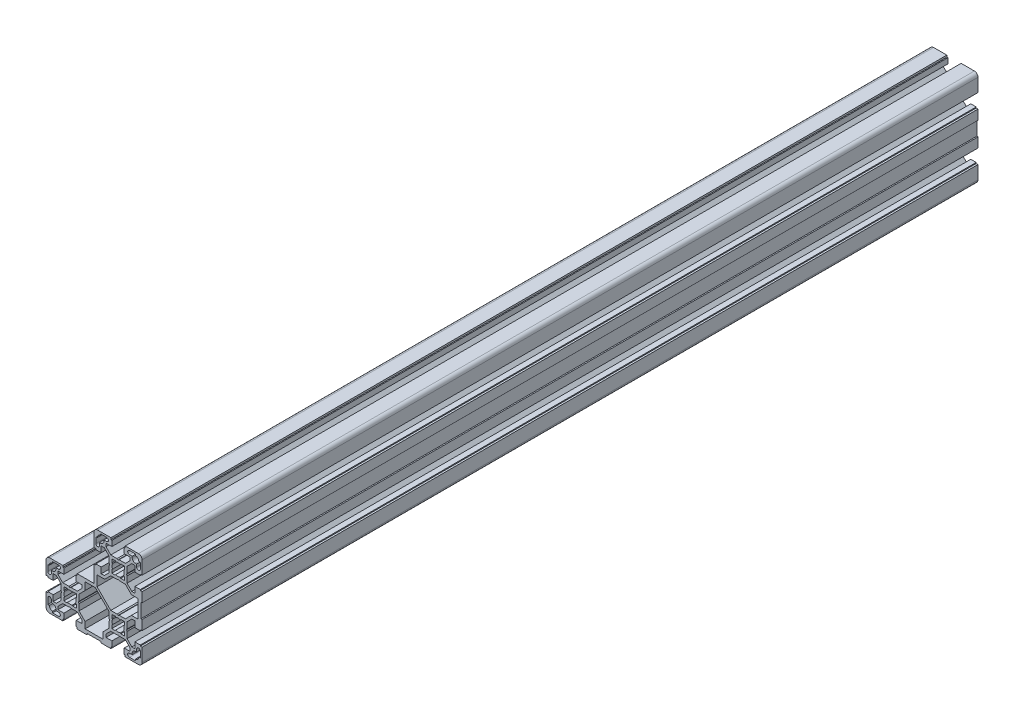
from build123d import *

# Parameters (mm, degrees)
EXTRUDE_1201_DEPTH = 348


with BuildPart() as part:
    # Model → Extrude 1201 (new, symmetric)
    with BuildSketch(Plane.XY):
        with BuildLine():
            Line((34.000012, 30.0499399), (34.000012, 25.15))
            Line((34.000012, 25.15), (38.500003, 25.15))
            Line((38.500003, 25.15), (38.500003, 25.95))
            Line((38.500003, 25.95), (40, 25.95))
            Line((40, 25.95), (40, 33.999932))
            Line((40, 33.999932), (39.000002, 33.999932))
            Line((39.000002, 33.999932), (39.000002, 46.000068))
            Line((39.000002, 46.000068), (40, 46.000068))
            Line((40, 46.000068), (40, 54.05))
            Line((40, 54.05), (38.500003, 54.05))
            Line((38.500003, 54.05), (38.500003, 54.85))
            Line((38.500003, 54.85), (34.000012, 54.85))
            Line((34.000012, 54.85), (34.000012, 49.9500601))
            Line((34.000012, 49.9500601), (31.464231072, 49.9500601))
            Line((31.464231072, 49.9500601), (27.500025, 53.914266172))
            Line((27.500025, 53.914266172), (27.500025, 59.134014596))
            Line((27.500025, 59.134014596), (27.000025, 60.00004))
            Line((27.000025, 60.00004), (27.500025, 60.866065404))
            Line((27.500025, 60.866065404), (27.500025, 66.085813828))
            Line((27.500025, 66.085813828), (31.464231072, 70.0500199))
            Line((31.464231072, 70.0500199), (34.000012, 70.0500199))
            Line((34.000012, 70.0500199), (34.000012, 65.15))
            Line((34.000012, 65.15), (38.500003, 65.15))
            Line((38.500003, 65.15), (38.500003, 65.95))
            Line((38.500003, 65.95), (40, 65.95))
            Line((40, 65.95), (40, 77))
            ThreePointArc((40, 77), (39.121320344, 79.121320344), (37, 80))
            Line((37, 80), (25.95, 80))
            Line((25.95, 80), (25.95, 78.500003))
            Line((25.95, 78.500003), (25.15, 78.500003))
            Line((25.15, 78.500003), (25.15, 74.000012))
            Line((25.15, 74.000012), (30.0500199, 74.000012))
            Line((30.0500199, 74.000012), (30.0500199, 71.464231072))
            Line((30.0500199, 71.464231072), (26.085813828, 67.500025))
            Line((26.085813828, 67.500025), (20.866065404, 67.500025))
            Line((20.866065404, 67.500025), (20.00004, 67.000025))
            Line((20.00004, 67.000025), (19.134014596, 67.500025))
            Line((19.134014596, 67.500025), (13.914266172, 67.500025))
            Line((13.914266172, 67.500025), (9.9500601, 71.464231072))
            Line((9.9500601, 71.464231072), (9.9500601, 74.000012))
            Line((9.9500601, 74.000012), (14.85, 74.000012))
            Line((14.85, 74.000012), (14.85, 78.500003))
            Line((14.85, 78.500003), (14.05, 78.500003))
            Line((14.05, 78.500003), (14.05, 80))
            Line((14.05, 80), (3.00008, 80))
            ThreePointArc((3.00008, 80), (0.878759656, 79.121320344), (8e-05, 77))
            Line((8e-05, 77), (8e-05, 65.95))
            Line((8e-05, 65.95), (1.500077, 65.95))
            Line((1.500077, 65.95), (1.500077, 65.15))
            Line((1.500077, 65.15), (6.000068, 65.15))
            Line((6.000068, 65.15), (6.000068, 70.0500199))
            Line((6.000068, 70.0500199), (8.535848928, 70.0500199))
            Line((8.535848928, 70.0500199), (12.500055, 66.085813828))
            Line((12.500055, 66.085813828), (12.500055, 60.866065404))
            Line((12.500055, 60.866065404), (13.000055, 60.00004))
            Line((13.000055, 60.00004), (12.500055, 59.134014596))
            Line((12.500055, 59.134014596), (12.500055, 53.914266172))
            Line((12.500055, 53.914266172), (8.535848928, 49.9500601))
            Line((8.535848928, 49.9500601), (6.000068, 49.9500601))
            Line((6.000068, 49.9500601), (6.000068, 54.85))
            Line((6.000068, 54.85), (1.500077, 54.85))
            Line((1.500077, 54.85), (1.500077, 54.05))
            Line((1.500077, 54.05), (8e-05, 54.05))
            Line((8e-05, 54.05), (8e-05, 40.550026889))
            Line((8e-05, 40.550026889), (0.188018624, 40.033670922))
            Line((0.188018624, 40.033670922), (-0.033670922, 39.811981376))
            Line((-0.033670922, 39.811981376), (-0.550026889, 39.99992))
            Line((-0.550026889, 39.99992), (-14.05, 39.99992))
            Line((-14.05, 39.99992), (-14.05, 38.499923))
            Line((-14.05, 38.499923), (-14.85, 38.499923))
            Line((-14.85, 38.499923), (-14.85, 33.999932))
            Line((-14.85, 33.999932), (-9.9500601, 33.999932))
            Line((-9.9500601, 33.999932), (-9.9500601, 31.464151072))
            Line((-9.9500601, 31.464151072), (-13.914266172, 27.499945))
            Line((-13.914266172, 27.499945), (-19.134014596, 27.499945))
            Line((-19.134014596, 27.499945), (-20.00004, 26.999945))
            Line((-20.00004, 26.999945), (-20.866065404, 27.499945))
            Line((-20.866065404, 27.499945), (-26.085813828, 27.499945))
            Line((-26.085813828, 27.499945), (-30.0500199, 31.464151072))
            Line((-30.0500199, 31.464151072), (-30.0500199, 33.999932))
            Line((-30.0500199, 33.999932), (-25.15, 33.999932))
            Line((-25.15, 33.999932), (-25.15, 38.499923))
            Line((-25.15, 38.499923), (-25.95, 38.499923))
            Line((-25.95, 38.499923), (-25.95, 39.99992))
            Line((-25.95, 39.99992), (-37, 39.99992))
            ThreePointArc((-37, 39.99992), (-39.121320344, 39.121240344), (-40, 36.99992))
            Line((-40, 36.99992), (-40, 25.95))
            Line((-40, 25.95), (-38.500003, 25.95))
            Line((-38.500003, 25.95), (-38.500003, 25.15))
            Line((-38.500003, 25.15), (-34.000012, 25.15))
            Line((-34.000012, 25.15), (-34.000012, 30.0499399))
            Line((-34.000012, 30.0499399), (-31.464231072, 30.0499399))
            Line((-31.464231072, 30.0499399), (-27.500025, 26.085733828))
            Line((-27.500025, 26.085733828), (-27.500025, 20.865985404))
            Line((-27.500025, 20.865985404), (-27.000025, 19.99996))
            Line((-27.000025, 19.99996), (-27.500025, 19.133934596))
            Line((-27.500025, 19.133934596), (-27.500025, 13.914186172))
            Line((-27.500025, 13.914186172), (-31.464231072, 9.9499801))
            Line((-31.464231072, 9.9499801), (-34.000012, 9.9499801))
            Line((-34.000012, 9.9499801), (-34.000012, 14.85))
            Line((-34.000012, 14.85), (-38.500003, 14.85))
            Line((-38.500003, 14.85), (-38.500003, 14.05))
            Line((-38.500003, 14.05), (-40, 14.05))
            Line((-40, 14.05), (-40, 3))
            ThreePointArc((-40, 3), (-39.121320344, 0.878679656), (-37, 0))
            Line((-37, 0), (-25.95, 0))
            Line((-25.95, 0), (-25.95, 1.499997))
            Line((-25.95, 1.499997), (-25.15, 1.499997))
            Line((-25.15, 1.499997), (-25.15, 5.999988))
            Line((-25.15, 5.999988), (-30.0500199, 5.999988))
            Line((-30.0500199, 5.999988), (-30.0500199, 8.535768928))
            Line((-30.0500199, 8.535768928), (-26.085813828, 12.499975))
            Line((-26.085813828, 12.499975), (-20.866065404, 12.499975))
            Line((-20.866065404, 12.499975), (-20.00004, 12.999975))
            Line((-20.00004, 12.999975), (-19.134014596, 12.499975))
            Line((-19.134014596, 12.499975), (-13.914266172, 12.499975))
            Line((-13.914266172, 12.499975), (-9.9500601, 8.535768928))
            Line((-9.9500601, 8.535768928), (-9.9500601, 5.999988))
            Line((-9.9500601, 5.999988), (-14.85, 5.999988))
            Line((-14.85, 5.999988), (-14.85, 1.499997))
            Line((-14.85, 1.499997), (-14.05, 1.499997))
            Line((-14.05, 1.499997), (-14.05, 0))
            Line((-14.05, 0), (-6.000068, 0))
            Line((-6.000068, 0), (-6.000068, 0.999998))
            Line((-6.000068, 0.999998), (6.000068, 0.999998))
            Line((6.000068, 0.999998), (6.000068, 0))
            Line((6.000068, 0), (14.05, 0))
            Line((14.05, 0), (14.05, 1.499997))
            Line((14.05, 1.499997), (14.85, 1.499997))
            Line((14.85, 1.499997), (14.85, 5.999988))
            Line((14.85, 5.999988), (9.9500601, 5.999988))
            Line((9.9500601, 5.999988), (9.9500601, 8.535768928))
            Line((9.9500601, 8.535768928), (13.914266172, 12.499975))
            Line((13.914266172, 12.499975), (19.134014596, 12.499975))
            Line((19.134014596, 12.499975), (20.00004, 12.999975))
            Line((20.00004, 12.999975), (20.866065404, 12.499975))
            Line((20.866065404, 12.499975), (26.085813828, 12.499975))
            Line((26.085813828, 12.499975), (30.0500199, 8.535768928))
            Line((30.0500199, 8.535768928), (30.0500199, 5.999988))
            Line((30.0500199, 5.999988), (25.15, 5.999988))
            Line((25.15, 5.999988), (25.15, 1.499997))
            Line((25.15, 1.499997), (25.95, 1.499997))
            Line((25.95, 1.499997), (25.95, 0))
            Line((25.95, 0), (37, 0))
            ThreePointArc((37, 0), (39.121320344, 0.878679656), (40, 3))
            Line((40, 3), (40, 14.05))
            Line((40, 14.05), (38.500003, 14.05))
            Line((38.500003, 14.05), (38.500003, 14.85))
            Line((38.500003, 14.85), (34.000012, 14.85))
            Line((34.000012, 14.85), (34.000012, 9.9499801))
            Line((34.000012, 9.9499801), (31.464231072, 9.9499801))
            Line((31.464231072, 9.9499801), (27.500025, 13.914186172))
            Line((27.500025, 13.914186172), (27.500025, 19.133934596))
            Line((27.500025, 19.133934596), (27.000025, 19.99996))
            Line((27.000025, 19.99996), (27.500025, 20.865985404))
            Line((27.500025, 20.865985404), (27.500025, 26.085733828))
            Line((27.500025, 26.085733828), (31.464231072, 30.0499399))
            Line((31.464231072, 30.0499399), (34.000012, 30.0499399))
        make_face()
        with BuildLine():
            Line((-35.500009, 31.7499255), (-35.500009, 29.499928))
            ThreePointArc((-35.500009, 29.499928), (-37.000006, 27.999931), (-38.500003, 29.499928))
            Line((-38.500003, 29.499928), (-38.500003, 34.499931))
            Line((-38.500003, 34.499931), (-37.2499945, 34.499931))
            ThreePointArc((-37.2499945, 34.499931), (-36.444539759, 36.444459759), (-34.500011, 37.2499145))
            Line((-34.500011, 37.2499145), (-34.500011, 38.499923))
            Line((-34.500011, 38.499923), (-29.500008, 38.499923))
            ThreePointArc((-29.500008, 38.499923), (-28.000011, 36.999926), (-29.500008, 35.499929))
            Line((-29.500008, 35.499929), (-31.7500165, 35.499929))
            Line((-31.7500165, 35.499929), (-31.7500165, 34.507698161))
            ThreePointArc((-31.7500165, 34.507698161), (-32.552712188, 32.558132183), (-34.5, 31.7499255))
            Line((-34.5, 31.7499255), (-35.500009, 31.7499255))
        make_face(mode=Mode.SUBTRACT)
        Polygon((1.085790828, 37.499998), (12.500055, 26.085733828), (12.500055, 20.865985404), (13.000055, 19.99996), (12.500055, 19.133934596), (12.500055, 13.914186172), (7.4500651, 8.864196272), (7.4500651, 3.499998), (-7.4500651, 3.499998), (-7.4500651, 8.864196272), (-12.500055, 13.914186172), (-12.500055, 19.133934596), (-13.000055, 19.99996), (-12.500055, 20.865985404), (-12.500055, 26.085733828), (-7.4500651, 31.135723728), (-7.4500651, 37.499998), align=None, mode=Mode.SUBTRACT)
        with BuildLine():
            Line((25.2000296, 14.7999704), (22.260323479, 14.7999704))
            Line((22.260323479, 14.7999704), (21.993234909, 15.414431235))
            ThreePointArc((21.993234909, 15.414431235), (20.00004, 14.99997), (18.006845091, 15.414431235))
            Line((18.006845091, 15.414431235), (17.739756521, 14.7999704))
            Line((17.739756521, 14.7999704), (14.8000504, 14.7999704))
            Line((14.8000504, 14.7999704), (14.8000504, 17.739676521))
            Line((14.8000504, 17.739676521), (15.414511235, 18.006765091))
            ThreePointArc((15.414511235, 18.006765091), (15.00005, 19.99996), (15.414511235, 21.993154909))
            Line((15.414511235, 21.993154909), (14.8000504, 22.260243479))
            Line((14.8000504, 22.260243479), (14.8000504, 25.1999496))
            Line((14.8000504, 25.1999496), (17.739756521, 25.1999496))
            Line((17.739756521, 25.1999496), (18.006845091, 24.585488765))
            ThreePointArc((18.006845091, 24.585488765), (20.00004, 24.99995), (21.993234909, 24.585488765))
            Line((21.993234909, 24.585488765), (22.260323479, 25.1999496))
            Line((22.260323479, 25.1999496), (25.2000296, 25.1999496))
            Line((25.2000296, 25.1999496), (25.2000296, 22.260243479))
            Line((25.2000296, 22.260243479), (24.585568765, 21.993154909))
            ThreePointArc((24.585568765, 21.993154909), (25.00003, 19.99996), (24.585568765, 18.006765091))
            Line((24.585568765, 18.006765091), (25.2000296, 17.739676521))
            Line((25.2000296, 17.739676521), (25.2000296, 14.7999704))
        make_face(mode=Mode.SUBTRACT)
        with BuildLine():
            Line((10.500072, 75.500009), (8.2500745, 75.500009))
            Line((8.2500745, 75.500009), (8.2500745, 74.5))
            ThreePointArc((8.2500745, 74.5), (7.441867817, 72.552712188), (5.492301839, 71.7500165))
            Line((5.492301839, 71.7500165), (4.500071, 71.7500165))
            Line((4.500071, 71.7500165), (4.500071, 69.500008))
            ThreePointArc((4.500071, 69.500008), (3.000074, 68.000011), (1.500077, 69.500008))
            Line((1.500077, 69.500008), (1.500077, 74.500011))
            Line((1.500077, 74.500011), (2.7500855, 74.500011))
            ThreePointArc((2.7500855, 74.500011), (3.555540241, 76.444539759), (5.500069, 77.2499945))
            Line((5.500069, 77.2499945), (5.500069, 78.500003))
            Line((5.500069, 78.500003), (10.500072, 78.500003))
            ThreePointArc((10.500072, 78.500003), (12.000069, 77.000006), (10.500072, 75.500009))
        make_face(mode=Mode.SUBTRACT)
        with BuildLine():
            Line((25.2000296, 65.2000296), (25.2000296, 62.260323479))
            Line((25.2000296, 62.260323479), (24.585568765, 61.993234909))
            ThreePointArc((24.585568765, 61.993234909), (25.00003, 60.00004), (24.585568765, 58.006845091))
            Line((24.585568765, 58.006845091), (25.2000296, 57.739756521))
            Line((25.2000296, 57.739756521), (25.2000296, 54.8000504))
            Line((25.2000296, 54.8000504), (22.260323479, 54.8000504))
            Line((22.260323479, 54.8000504), (21.993234909, 55.414511235))
            ThreePointArc((21.993234909, 55.414511235), (20.00004, 55.00005), (18.006845091, 55.414511235))
            Line((18.006845091, 55.414511235), (17.739756521, 54.8000504))
            Line((17.739756521, 54.8000504), (14.8000504, 54.8000504))
            Line((14.8000504, 54.8000504), (14.8000504, 57.739756521))
            Line((14.8000504, 57.739756521), (15.414511235, 58.006845091))
            ThreePointArc((15.414511235, 58.006845091), (15.00005, 60.00004), (15.414511235, 61.993234909))
            Line((15.414511235, 61.993234909), (14.8000504, 62.260323479))
            Line((14.8000504, 62.260323479), (14.8000504, 65.2000296))
            Line((14.8000504, 65.2000296), (17.739756521, 65.2000296))
            Line((17.739756521, 65.2000296), (18.006845091, 64.585568765))
            ThreePointArc((18.006845091, 64.585568765), (20.00004, 65.00003), (21.993234909, 64.585568765))
            Line((21.993234909, 64.585568765), (22.260323479, 65.2000296))
            Line((22.260323479, 65.2000296), (25.2000296, 65.2000296))
        make_face(mode=Mode.SUBTRACT)
        Polygon((2.500002, 38.914209172), (2.500002, 47.4500651), (8.864276272, 47.4500651), (13.914266172, 52.500055), (19.134014596, 52.500055), (20.00004, 53.000055), (20.866065404, 52.500055), (26.085813828, 52.500055), (31.135803728, 47.4500651), (36.500002, 47.4500651), (36.500002, 32.5499349), (31.135803728, 32.5499349), (26.085813828, 27.499945), (20.866065404, 27.499945), (20.00004, 26.999945), (19.134014596, 27.499945), (13.914266172, 27.499945), align=None, mode=Mode.SUBTRACT)
        with BuildLine():
            Line((31.7500055, 75.500009), (29.500008, 75.500009))
            ThreePointArc((29.500008, 75.500009), (28.000011, 77.000006), (29.500008, 78.500003))
            Line((29.500008, 78.500003), (34.500011, 78.500003))
            Line((34.500011, 78.500003), (34.500011, 77.2499945))
            ThreePointArc((34.500011, 77.2499945), (36.444539759, 76.444539759), (37.2499945, 74.500011))
            Line((37.2499945, 74.500011), (38.500003, 74.500011))
            Line((38.500003, 74.500011), (38.500003, 69.500008))
            ThreePointArc((38.500003, 69.500008), (37.000006, 68.000011), (35.500009, 69.500008))
            Line((35.500009, 69.500008), (35.500009, 71.7500165))
            Line((35.500009, 71.7500165), (34.507778159, 71.7500165))
            ThreePointArc((34.507778159, 71.7500165), (32.558212183, 72.552712188), (31.7500055, 74.5))
            Line((31.7500055, 74.5), (31.7500055, 75.500009))
        make_face(mode=Mode.SUBTRACT)
        with BuildLine():
            Line((-22.260323479, 14.7999704), (-25.2000296, 14.7999704))
            Line((-25.2000296, 14.7999704), (-25.2000296, 17.739676521))
            Line((-25.2000296, 17.739676521), (-24.585568765, 18.006765091))
            ThreePointArc((-24.585568765, 18.006765091), (-25.00003, 19.99996), (-24.585568765, 21.993154909))
            Line((-24.585568765, 21.993154909), (-25.2000296, 22.260243479))
            Line((-25.2000296, 22.260243479), (-25.2000296, 25.1999496))
            Line((-25.2000296, 25.1999496), (-22.260323479, 25.1999496))
            Line((-22.260323479, 25.1999496), (-21.993234909, 24.585488765))
            ThreePointArc((-21.993234909, 24.585488765), (-20.00004, 24.99995), (-18.006845091, 24.585488765))
            Line((-18.006845091, 24.585488765), (-17.739756521, 25.1999496))
            Line((-17.739756521, 25.1999496), (-14.8000504, 25.1999496))
            Line((-14.8000504, 25.1999496), (-14.8000504, 22.260243479))
            Line((-14.8000504, 22.260243479), (-15.414511235, 21.993154909))
            ThreePointArc((-15.414511235, 21.993154909), (-15.00005, 19.99996), (-15.414511235, 18.006765091))
            Line((-15.414511235, 18.006765091), (-14.8000504, 17.739676521))
            Line((-14.8000504, 17.739676521), (-14.8000504, 14.7999704))
            Line((-14.8000504, 14.7999704), (-17.739756521, 14.7999704))
            Line((-17.739756521, 14.7999704), (-18.006845091, 15.414431235))
            ThreePointArc((-18.006845091, 15.414431235), (-20.00004, 14.99997), (-21.993234909, 15.414431235))
            Line((-21.993234909, 15.414431235), (-22.260323479, 14.7999704))
        make_face(mode=Mode.SUBTRACT)
        with BuildLine():
            Line((-35.500009, 10.499992), (-35.500009, 8.2499945))
            Line((-35.500009, 8.2499945), (-34.5, 8.2499945))
            ThreePointArc((-34.5, 8.2499945), (-32.552712188, 7.441787817), (-31.7500165, 5.492221839))
            Line((-31.7500165, 5.492221839), (-31.7500165, 4.499991))
            Line((-31.7500165, 4.499991), (-29.500008, 4.499991))
            ThreePointArc((-29.500008, 4.499991), (-28.000011, 2.999994), (-29.500008, 1.499997))
            Line((-29.500008, 1.499997), (-34.500011, 1.499997))
            Line((-34.500011, 1.499997), (-34.500011, 2.7500055))
            ThreePointArc((-34.500011, 2.7500055), (-36.444539759, 3.555460241), (-37.2499945, 5.499989))
            Line((-37.2499945, 5.499989), (-38.500003, 5.499989))
            Line((-38.500003, 5.499989), (-38.500003, 10.499992))
            ThreePointArc((-38.500003, 10.499992), (-37.000006, 11.999989), (-35.500009, 10.499992))
        make_face(mode=Mode.SUBTRACT)
        with BuildLine():
            Line((35.500009, 8.2499945), (35.500009, 10.499992))
            ThreePointArc((35.500009, 10.499992), (37.000006, 11.999989), (38.500003, 10.499992))
            Line((38.500003, 10.499992), (38.500003, 5.499989))
            Line((38.500003, 5.499989), (37.2499945, 5.499989))
            ThreePointArc((37.2499945, 5.499989), (36.444539759, 3.555460241), (34.500011, 2.7500055))
            Line((34.500011, 2.7500055), (34.500011, 1.499997))
            Line((34.500011, 1.499997), (29.500008, 1.499997))
            ThreePointArc((29.500008, 1.499997), (28.000011, 2.999994), (29.500008, 4.499991))
            Line((29.500008, 4.499991), (31.7500165, 4.499991))
            Line((31.7500165, 4.499991), (31.7500165, 5.492221841))
            ThreePointArc((31.7500165, 5.492221841), (32.552712188, 7.441787817), (34.5, 8.2499945))
            Line((34.5, 8.2499945), (35.500009, 8.2499945))
        make_face(mode=Mode.SUBTRACT)
    extrude(amount=EXTRUDE_1201_DEPTH, both=True)


solid = part.part
